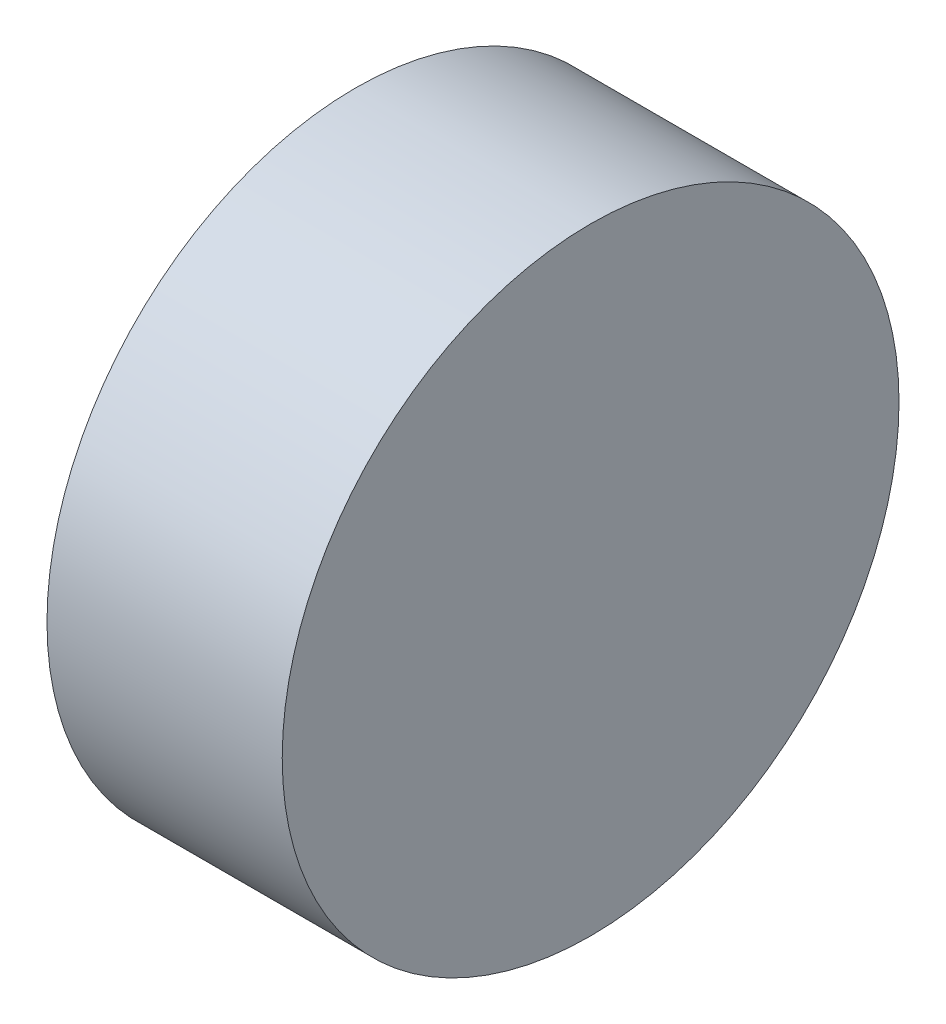
from build123d import *

# Parameters (mm, degrees)
BOSS_EXTRUDE1_DEPTH      = 12.7
BOSS_EXTRUDE1_DEPTH_BACK = 12.7
SKETCH1_R                = 33.3


with BuildPart() as part:
    # Sketch1 → Boss-Extrude1 (new, two sides: drawn at the far end of the back side and taken through both)
    with BuildSketch(Plane(origin=(0, 0, 0), x_dir=(0, 0, -1), z_dir=(1, 0, 0)).offset(-BOSS_EXTRUDE1_DEPTH_BACK)):
        Circle(SKETCH1_R)
    extrude(amount=BOSS_EXTRUDE1_DEPTH + BOSS_EXTRUDE1_DEPTH_BACK)


solid = part.part
